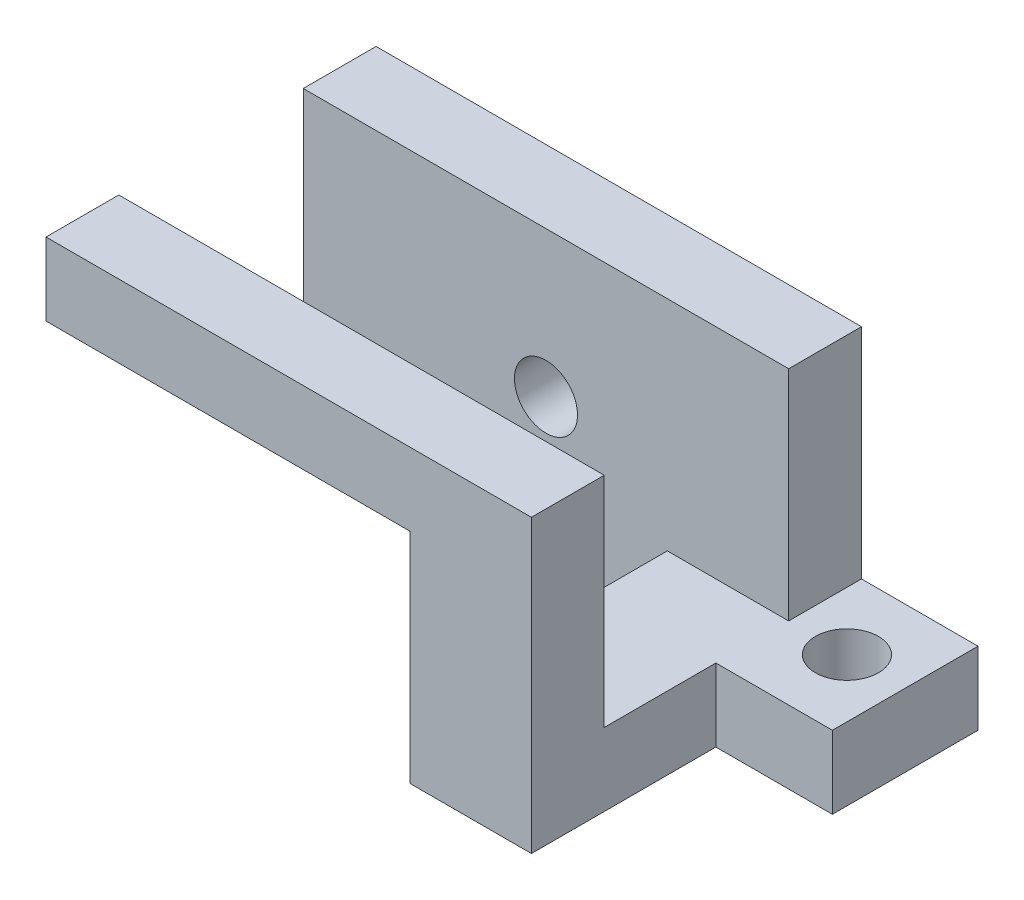
from build123d import *

# Parameters (mm, degrees)
BOSS_EXTRUDE1_DEPTH     = 68
SKETCH1_3_W             = 24
SKETCH1_3_H             = 15
BOSS_EXTRUDE2_DEPTH     = 30
SKETCH2_R               = 6.5
CUT_EXTRUDE1_DEPTH      = 40
SKETCH3_W               = 38
SKETCH3_H               = 45
CUT_EXTRUDE2_DEPTH      = 113
CUT_EXTRUDE3_DEPTH      = 105.880884817
CUT_EXTRUDE3_DEPTH_BACK = 53
SKETCH4_W               = 75
SKETCH4_H               = 45
SKETCH5_R               = 6.5
CUT_EXTRUDE4_DEPTH      = 38


with BuildPart() as part:
    # Sketch1 → Boss-Extrude1 (new body)
    with BuildSketch(Plane.XY):
        Polygon((-50, -30), (50, -30), (50, -15), (50, 30), (-50, 30), align=None)
    extrude(amount=BOSS_EXTRUDE1_DEPTH)

    # Sketch1<3> → Boss-Extrude2 (add)
    with BuildSketch(Plane.XY):
        with Locations((62, -22.5)):
            Rectangle(SKETCH1_3_W, SKETCH1_3_H)
    extrude(amount=BOSS_EXTRUDE2_DEPTH)

    # Sketch2 → Cut-Extrude1 (cut)
    with BuildSketch(Plane(origin=(0, -15, 0), x_dir=(1, 0, 0), z_dir=(0, 1, 0))):
        with Locations((62, -15)):
            Circle(SKETCH2_R)
    extrude(amount=-CUT_EXTRUDE1_DEPTH, mode=Mode.SUBTRACT)

    # Sketch3 → Cut-Extrude2 (cut)
    with BuildSketch(Plane(origin=(50, 0, 0), x_dir=(0, 0, -1), z_dir=(1, 0, 0))):
        with Locations((-34, 7.5)):
            Rectangle(SKETCH3_W, SKETCH3_H)
    extrude(amount=-CUT_EXTRUDE2_DEPTH, mode=Mode.SUBTRACT)

    # Sketch4 → Cut-Extrude3 (cut, two sides: drawn at the far end of the back side and taken through both)
    with BuildSketch(Plane.XY.offset(68).offset(-CUT_EXTRUDE3_DEPTH_BACK)):
        with Locations((-12.5, -7.5)):
            Rectangle(SKETCH4_W, SKETCH4_H)
    extrude(amount=CUT_EXTRUDE3_DEPTH + CUT_EXTRUDE3_DEPTH_BACK, mode=Mode.SUBTRACT)

    # Sketch5 → Cut-Extrude4 (cut)
    with BuildSketch(Plane(origin=(0, 0, 0), x_dir=(-1, 0, 0), z_dir=(0, 0, -1))):
        Circle(SKETCH5_R)
    extrude(amount=-CUT_EXTRUDE4_DEPTH, mode=Mode.SUBTRACT)


solid = part.part
